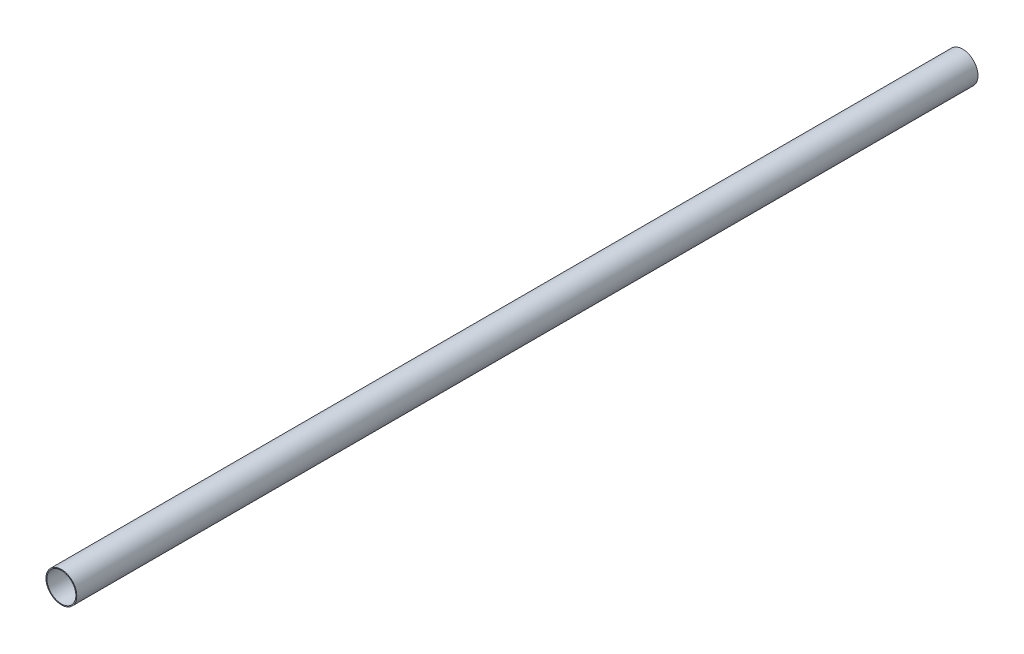
from build123d import *

# Parameters (mm, degrees)
SKETCH1_R           = 12.1539
SKETCH1_R_2         = 11.43
BOSS_EXTRUDE1_DEPTH = 711.2


with BuildPart() as part:
    # Sketch1 → Boss-Extrude1 (new body)
    with BuildSketch(Plane.XY):
        with Locations((8757.126883099, 3099.872573976)):
            Circle(SKETCH1_R)
        with Locations((8757.126883099, 3099.872573976)):
            Circle(SKETCH1_R_2, mode=Mode.SUBTRACT)
    extrude(amount=BOSS_EXTRUDE1_DEPTH)


solid = part.part
